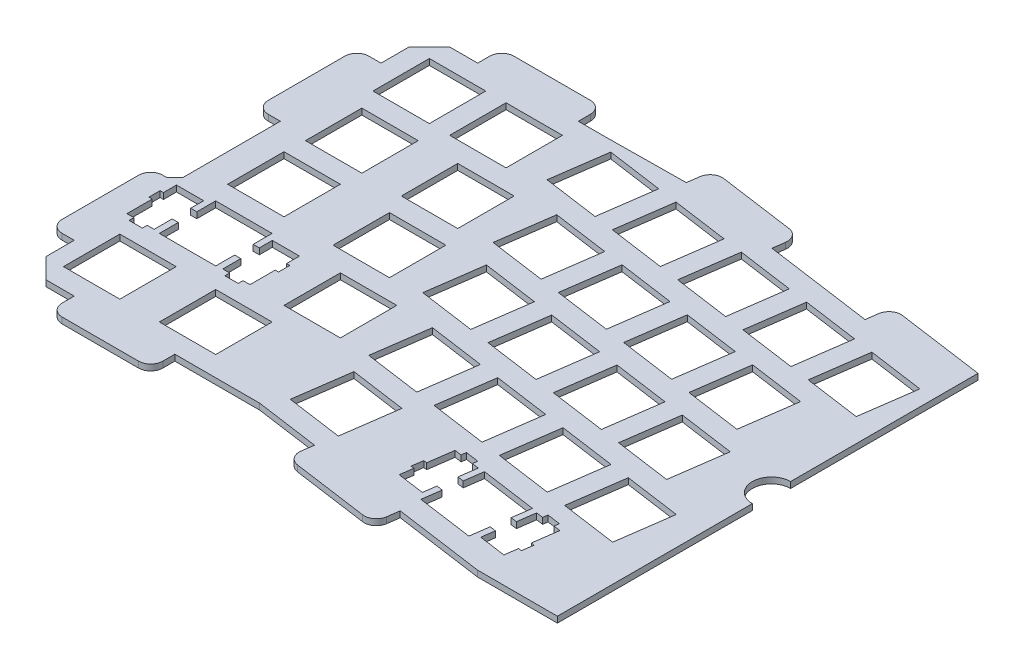
from build123d import *

# Parameters (mm, degrees)
BOSS_EXTRUDE1_DEPTH = 1.5
SKETCH2_W           = 14
SKETCH2_H           = 14
CUT_EXTRUDE1_DEPTH  = 1.5
SKETCH3_W           = 6
SKETCH3_H           = 25
SKETCH3_W_2         = 25
SKETCH3_H_2         = 6
BOSS_EXTRUDE2_DEPTH = 1.5
FILLET1_R           = 3
CHAMFER1_SIZE       = 5
CUT_EXTRUDE2_DEPTH  = 10
SKETCH5_R           = 4.75
CUT_EXTRUDE3_DEPTH  = 170.946862531
SKETCH6_W           = 33.692308385
SKETCH6_H           = 17.573728958
BOSS_EXTRUDE3_DEPTH = 1.5
CUT_EXTRUDE4_DEPTH  = 1.5
CHAMFER2_SIZE       = 2


with BuildPart() as part:
    # Sketch1 → Boss-Extrude1 (new body)
    with BuildSketch(Plane(origin=(0, 0, 0), x_dir=(1, 0, 0), z_dir=(0, 1, 0))):
        Polygon((39.045965758, 95.205083501), (-4.332989453, 95.205083501), (-4.332989453, -5), (53.746442199, -5), (116.69899904, -13.847404885), (136.518193504, -13.847404885), (136.518193504, 84.557681441), (39.466509281, 98.19740615), align=None)
    extrude(amount=-BOSS_EXTRUDE1_DEPTH)

    # Sketch2 → Cut-Extrude1 (cut)
    with BuildSketch(Plane(origin=(0, 0, 0), x_dir=(-1, 0, 0), z_dir=(0, -1, 0))):
        with Locations((-9.668032188, 45.102416218)):
            Rectangle(SKETCH2_W, SKETCH2_H)
        with Locations((-35.863224574, 45.102416218)):
            Rectangle(SKETCH2_W, SKETCH2_H)
        with Locations((-234.185537286, 44.352416218)):
            Rectangle(SKETCH2_W, SKETCH2_H)
        Polygon((-180.069515273, 51.038086867), (-178.121091859, 64.90183983), (-191.984844822, 66.850263243), (-193.933268235, 52.986510281), align=None)
        Polygon((-118.615175166, 48.647618801), (-104.751422203, 50.596042214), (-106.699845617, 64.459795177), (-120.563598579, 62.511371763), align=None)
        Polygon((-161.204167832, 48.387952413), (-159.255744418, 62.251705375), (-173.119497381, 64.200128789), (-175.067920794, 50.336375826), align=None)
        Polygon((-154.2536368, 61.546731419), (-156.202060214, 47.682978456), (-142.338307252, 45.734555043), (-140.389883838, 59.598308005), align=None)
        Polygon((-80.883592133, 53.950539723), (-67.01983917, 55.898963137), (-68.968262584, 69.762716099), (-82.832015546, 67.814292686), align=None)
        Polygon((-198.934792178, 53.688822528), (-196.986368764, 67.55257549), (-210.850121727, 69.500998903), (-212.79854514, 55.637245941), align=None)
        with Locations((-322.96393406, 58.640784798)):
            Rectangle(SKETCH2_W, SKETCH2_H)
        Polygon((-87.834278404, 67.110712128), (-101.698031366, 65.162288715), (-99.749607953, 51.298535752), (-85.88585499, 53.246959166), align=None)
        with Locations((-246.187266863, 63.403574324)):
            Rectangle(SKETCH2_W, SKETCH2_H)
        with Locations((-265.238424969, 63.403574324)):
            Rectangle(SKETCH2_W, SKETCH2_H)
        with Locations((-289.052872631, 63.403574324)):
            Rectangle(SKETCH2_W, SKETCH2_H)
        Polygon((-50.100014552, 72.41639575), (-63.963767514, 70.467972336), (-62.015344101, 56.604219374), (-48.151591138, 58.552642788), align=None)
        Polygon((-158.019711747, -8.301004785), (-157.569996377, -5.102507014), (-156.7539714, -5.217089515), (-156.36335122, -2.444404927), (-157.179376197, -2.329822426), (-156.308920813, 3.883635048), (-158.019681648, 4.123305782), (-157.852893703, 5.311279215), (-161.120178356, 5.770966057), (-161.286966042, 4.58161254), (-162.9951147, 4.821087611), (-163.616324776, 0.395822335), (-165.12645598, 0.606352683), (-164.474287078, 5.261817748), (-178.33804004, 7.210241161), (-178.991498382, 2.556075933), (-180.501662214, 2.767805684), (-179.880128073, 7.193176143), (-181.589313822, 7.433770026), (-181.421707286, 8.621759261), (-184.690062177, 9.080936661), (-184.856668188, 7.891577681), (-186.565853923, 8.132131561), (-187.435796745, 1.9220081), (-188.253885303, 2.036137069), (-188.6407454, -0.735186804), (-187.823656903, -0.849316114), (-188.272596855, -4.049463377), (-181.588872068, -4.985649306), (-181.13993164, -1.786902128), (-179.628767758, -1.998601538), (-180.283040344, -6.653992888), (-166.419287381, -8.602416301), (-165.765246552, -3.948673985), (-164.255200441, -4.161211733), (-164.704915811, -7.359709504), align=None)
        Polygon((-149.11796192, 65.920182917), (-147.169538506, 79.78393588), (-161.033291469, 81.732359293), (-162.981714882, 67.868606331), align=None)
        with Locations((-9.953349532, 64.153574324)):
            Rectangle(SKETCH2_W, SKETCH2_H)
        with Locations((-33.76869725, 64.153574324)):
            Rectangle(SKETCH2_W, SKETCH2_H)
        with Locations((-227.136108757, 63.403574324)):
            Rectangle(SKETCH2_W, SKETCH2_H)
        with Locations((-317.819621341, 1.487240475)):
            Rectangle(SKETCH2_W, SKETCH2_H)
        Polygon((-186.85036274, 71.227115774), (-184.901939327, 85.090868736), (-198.765692289, 87.03929215), (-200.714115703, 73.175539187), align=None)
        Polygon((-111.833635057, 68.839707794), (-97.969882094, 70.788131208), (-99.918305508, 84.65188417), (-113.78205847, 82.703460757), align=None)
        Polygon((-167.984780551, 68.577553418), (-166.036357138, 82.44130638), (-179.9001101, 84.389729793), (-181.848533513, 70.525976831), align=None)
        Polygon((-118.782750207, 82.000762559), (-132.646503169, 80.052339146), (-130.698079756, 66.188586183), (-116.834326793, 68.137009597), align=None)
        Polygon((-109.593099656, 1.590456432), (-111.104192143, 1.378248006), (-111.725216783, 5.806119012), (-113.434321388, 5.566309496), (-113.601328022, 6.754282206), (-116.868527992, 6.295363984), (-116.701521361, 5.106091194), (-118.412100582, 4.865622818), (-117.540539141, -1.344083322), (-118.357579438, -1.458557181), (-117.967328677, -4.231333791), (-117.15028849, -4.11550985), (-116.69899904, -7.315467432), (-110.015669744, -6.375063026), (-110.464958957, -3.176515366), (-108.95488455, -2.964078805), (-108.29946364, -7.617978062), (-94.435710678, -5.669554648), (-95.090671173, -1.014250495), (-93.579575699, -0.802063343), (-93.130602906, -4.000655434), (-86.445280497, -3.060922216), (-86.894753343, 0.136379804), (-86.077301679, 0.252072909), (-86.467478152, 3.024948118), (-87.284529769, 2.910555086), (-88.158277101, 9.118947378), (-89.865884991, 8.879161897), (-90.032374871, 10.06713695), (-93.30138141, 9.608264754), (-93.133391438, 8.420389682), (-94.842499419, 8.180604226), (-94.220537055, 3.75272446), (-95.729632386, 3.541837354), (-96.384372727, 8.194164776), (-110.248125689, 6.245741363), align=None)
        Polygon((-70.569538559, -2.315194142), (-56.705785596, -0.366770729), (-58.65420901, 13.496982234), (-72.517961972, 11.54855882), align=None)
        Polygon((-197.078489417, -4.296643347), (-195.130066004, 9.567109615), (-208.993818966, 11.515533029), (-210.94224238, -2.348219934), align=None)
        with Locations((-279.717305129, 1.487240475)):
            Rectangle(SKETCH2_W, SKETCH2_H)
        with Locations((-298.768463235, 1.487240475)):
            Rectangle(SKETCH2_W, SKETCH2_H)
        with Locations((-322.96393406, 82.45473243)):
            Rectangle(SKETCH2_W, SKETCH2_H)
        Polygon((-74.102047689, 74.142974794), (-60.238294726, 76.091398208), (-62.18671814, 89.95515117), (-76.050471102, 88.006727757), align=None)
        Polygon((-205.716164344, 73.880034967), (-203.76774093, 87.743787929), (-217.631493893, 89.692211343), (-219.579917306, 75.828458381), align=None)
        Polygon((-81.052841084, 87.303307487), (-94.916594046, 85.354884074), (-92.968170633, 71.491131111), (-79.10441767, 73.439554525), align=None)
        with Locations((-6.998481741, 7.003238337)):
            Rectangle(SKETCH2_W, SKETCH2_H)
        with Locations((-30.815317716, 7)):
            Rectangle(SKETCH2_W, SKETCH2_H)
        with Locations((-236.852699421, 6.25)):
            Rectangle(SKETCH2_W, SKETCH2_H)
        with Locations((-255.901857405, 6.25)):
            Rectangle(SKETCH2_W, SKETCH2_H)
        with Locations((-233.805365226, 82.45473243)):
            Rectangle(SKETCH2_W, SKETCH2_H)
        with Locations((-252.853672108, 82.45473243)):
            Rectangle(SKETCH2_W, SKETCH2_H)
        with Locations((-271.905830275, 82.45473243)):
            Rectangle(SKETCH2_W, SKETCH2_H)
        with Locations((-290.956988381, 82.45473243)):
            Rectangle(SKETCH2_W, SKETCH2_H)
        Polygon((-108.592251265, 11.582331056), (-94.728498302, 13.53075447), (-96.676921716, 27.394507432), (-110.540674678, 25.446084019), align=None)
        Polygon((-161.788545221, 9.991186757), (-159.840121808, 23.854939719), (-173.70387477, 25.803363133), (-175.652298184, 11.93961017), align=None)
        Polygon((-127.460208932, 8.930145226), (-113.59645597, 10.87856864), (-115.544879383, 24.742321602), (-129.408632345, 22.793898189), align=None)
        Polygon((-154.838722397, 23.151841648), (-156.787145811, 9.288088686), (-142.923392848, 7.339665272), (-140.974969435, 21.203418235), align=None)
        Polygon((-55.233717661, 76.795522435), (-41.369964699, 78.743945848), (-43.318388112, 92.607698811), (-57.182141074, 90.659275397), align=None)
        with Locations((-7.667010547, 83.205083501)):
            Rectangle(SKETCH2_W, SKETCH2_H)
        with Locations((-26.718168653, 83.20473243)):
            Rectangle(SKETCH2_W, SKETCH2_H)
        Polygon((-199.52007302, 15.292392375), (-197.571649607, 29.156145338), (-211.435402569, 31.104568751), (-213.383825983, 17.240815789), align=None)
        with Locations((-298.578451684, 20.53836858)):
            Rectangle(SKETCH2_W, SKETCH2_H)
        Polygon((-89.728743935, 14.231849796), (-75.864990972, 16.18027321), (-77.813414386, 30.044026172), (-91.677167348, 28.095602759), align=None)
        Polygon((-192.570245983, 28.454627882), (-194.518669396, 14.59087492), (-180.654916434, 12.642451506), (-178.70649302, 26.506204468), align=None)
        Polygon((-58.950293343, 32.692188142), (-72.814046306, 30.743764728), (-70.865622892, 16.880011766), (-57.00186993, 18.82843518), align=None)
        with Locations((-246.187266863, 25.301158106)):
            Rectangle(SKETCH2_W, SKETCH2_H)
        with Locations((-270.001714525, 25.301158106)):
            Rectangle(SKETCH2_W, SKETCH2_H)
        Polygon((-120.681140481, 29.119160818), (-106.817387518, 31.067584231), (-108.765810932, 44.931337194), (-122.629563894, 42.98291378), align=None)
        Polygon((-149.70549572, 27.532693306), (-147.757072306, 41.396446268), (-161.620825269, 43.344869682), (-163.569248682, 29.481116719), align=None)
        with Locations((-42.722341535, 26.051158106)):
            Rectangle(SKETCH2_W, SKETCH2_H)
        with Locations((-227.23185535, 25.301158106)):
            Rectangle(SKETCH2_W, SKETCH2_H)
        Polygon((-29.421107438, 31.582068801), (-29.421107438, 28.35187244), (-30.245257537, 28.35187244), (-30.245257537, 25.551953285), (-29.421107438, 25.551953285), (-29.421107438, 19.281372101), (-27.695902564, 19.281372101), (-27.695902564, 18.080999131), (-24.395201917, 18.080999131), (-24.395201917, 19.281372101), (-22.671197116, 19.281372101), (-22.671197116, 23.751943863), (-21.145604376, 23.751943863), (-21.145604376, 19.051158106), (-7.145604376, 19.051158106), (-7.145604376, 23.751943863), (-5.620011636, 23.751943863), (-5.620011636, 19.281372101), (-3.894506744, 19.281372101), (-3.894506744, 18.080999131), (-0.594006109, 18.080999131), (-0.594006109, 19.281372101), (1.130048695, 19.281372101), (1.130048695, 25.551953285), (1.955568878, 25.551953285), (1.955568878, 28.352123505), (1.130048695, 28.352123505), (1.130048695, 31.582319866), (-5.620011636, 31.582319866), (-5.620011636, 28.352123505), (-7.145604376, 28.352123505), (-7.145604376, 33.051158106), (-21.145604376, 33.051158106), (-21.145604376, 28.35187244), (-22.671197116, 28.35187244), (-22.671197116, 31.582068801), align=None)
        with Locations((-322.96393406, 39.589626692)):
            Rectangle(SKETCH2_W, SKETCH2_H)
        Polygon((-187.437211725, 32.834012067), (-185.488788311, 46.697765029), (-199.352541274, 48.646188443), (-201.300964687, 34.78243548), align=None)
        Polygon((-101.814497943, 31.769730407), (-87.950744981, 33.718153821), (-89.899168394, 47.581906783), (-103.762921357, 45.63348337), align=None)
        Polygon((-180.486814754, 45.997649448), (-182.435238167, 32.133896486), (-168.571485205, 30.185473073), (-166.623061792, 44.049226035), align=None)
        Polygon((-64.081134293, 37.074257567), (-50.217381331, 39.02268098), (-52.165804744, 52.886433942), (-66.029557706, 50.938010529), align=None)
        Polygon((-206.302405022, 35.483942028), (-204.353981609, 49.347694991), (-218.217734571, 51.296118404), (-220.166157984, 37.432365442), align=None)
        Polygon((-71.033829817, 50.233426184), (-84.89758278, 48.285002771), (-82.949159366, 34.421249808), (-69.085406404, 36.369673222), align=None)
        with Locations((-253.236695392, 44.352416218)):
            Rectangle(SKETCH2_W, SKETCH2_H)
        Polygon((-294.443774816, 36.382257243), (-294.443774816, 37.5824302), (-292.719670009, 37.5824302), (-292.719670009, 42.053101969), (-291.194577299, 42.053101969), (-291.194577299, 37.352416218), (-277.194577299, 37.352416218), (-277.194577299, 42.053101969), (-275.66948459, 42.053101969), (-275.66948459, 37.5824302), (-273.943379661, 37.5824302), (-273.943379661, 36.382257243), (-270.643179045, 36.382257243), (-270.643179045, 37.5824302), (-268.919074237, 37.5824302), (-268.919074237, 43.853111391), (-268.094024083, 43.853111391), (-268.094024083, 46.653281611), (-268.919074237, 46.653281611), (-268.919074237, 49.883477972), (-275.66948459, 49.883477972), (-275.66948459, 46.653281611), (-277.194577299, 46.653281611), (-277.194577299, 51.352416218), (-291.194577299, 51.352416218), (-291.194577299, 46.653130552), (-292.719670009, 46.653130552), (-292.719670009, 49.883326913), (-299.470080361, 49.883326913), (-299.470080361, 46.653130552), (-300.294130454, 46.653130552), (-300.294130454, 43.853111391), (-299.470080361, 43.853111391), (-299.470080361, 37.5824302), (-297.743975432, 37.5824302), (-297.743975432, 36.382257243), align=None)
    extrude(amount=CUT_EXTRUDE1_DEPTH, mode=Mode.SUBTRACT)

    # Sketch3 → Boss-Extrude2 (add)
    with BuildSketch(Plane(origin=(0, 0, 0), x_dir=(1, 0, 0), z_dir=(0, 1, 0))):
        with Locations((-7.332989453, 70.705083501)):
            Rectangle(SKETCH3_W, SKETCH3_H)
        with Locations((-7.332989453, 19.5)):
            Rectangle(SKETCH3_W, SKETCH3_H)
        with Locations((20.167010547, -8)):
            Rectangle(SKETCH3_W_2, SKETCH3_H_2)
        Polygon((69.590731299, -7.226769615), (94.347433018, -10.706097139), (93.512394412, -16.647705552), (68.755692694, -13.168378028), align=None)
        with Locations((20.167010547, 98.205083501)):
            Rectangle(SKETCH3_W_2, SKETCH3_H_2)
        Polygon((59.271870656, 95.413944131), (84.028572374, 91.934616607), (84.86361098, 97.87622502), (60.106909262, 101.355552544), align=None)
        Polygon((110.926453179, 88.154365987), (136.518193504, 84.557681441), (136.518193504, 90.616646876), (111.761491785, 94.0959744), align=None)
    extrude(amount=-BOSS_EXTRUDE2_DEPTH)

    # Fillet1
    fillet1_edges = [part.edges().sort_by_distance(p)[0] for p in [
        (93.512394412, -0.75, 16.647705552),
        (68.755692694, -0.75, 13.168378028),
        (32.667010547, -0.75, 11),
        (7.667010547, -0.75, 11),
        (-10.332989453, -0.75, -7),
        (-10.332989453, -0.75, -32),
        (-10.332989453, -0.75, -58.205083501),
        (-10.332989453, -0.75, -83.205083501),
        (111.761491785, -0.75, -94.0959744),
        (84.86361098, -0.75, -97.87622502),
        (60.106909262, -0.75, -101.355552544),
        (32.667010547, -0.75, -101.205083501),
        (7.667010547, -0.75, -101.205083501),
    ]]
    fillet(fillet1_edges, radius=FILLET1_R)

    # Chamfer1
    chamfer1_edges = [part.edges().sort_by_distance(p)[0] for p in [
        (-4.332989453, -0.75, 5),
        (-4.332989453, -0.75, -95.205083501),
    ]]
    chamfer(chamfer1_edges, length=CHAMFER1_SIZE)

    # Sketch4 → Cut-Extrude2 (cut)
    with BuildSketch(Plane(origin=(0, 0, 0), x_dir=(1, 0, 0), z_dir=(0, 1, 0))):
        Polygon((59.271870656, 95.413944131), (39.045965758, 95.205083501), (39.466509281, 98.19740615), align=None)
    extrude(amount=-CUT_EXTRUDE2_DEPTH, mode=Mode.SUBTRACT)

    # Sketch5 → Cut-Extrude3 (cut, through all)
    with BuildSketch(Plane(origin=(0, 0, 0), x_dir=(1, 0, 0), z_dir=(0, 1, 0))):
        with Locations((136.518193504, 39.320563904)):
            Circle(SKETCH5_R)
    extrude(amount=-CUT_EXTRUDE3_DEPTH, mode=Mode.SUBTRACT)

    # Sketch6 → Boss-Extrude3 (add)
    with BuildSketch(Plane(origin=(0, 0, 0), x_dir=(1, 0, 0), z_dir=(0, 1, 0))):
        with Locations((14.655669489, 26.42047638)):
            Rectangle(SKETCH6_W, SKETCH6_H)
    extrude(amount=-BOSS_EXTRUDE3_DEPTH)

    # Sketch7 → Cut-Extrude4 (cut)
    with BuildSketch(Plane(origin=(0, 0, 0), x_dir=(1, 0, 0), z_dir=(0, 1, 0))):
        Polygon((27.039857438, 28.35187244), (27.039857438, 31.582068801), (20.289947116, 31.582068801), (20.289947116, 28.35187244), (18.764354376, 28.35187244), (18.764354376, 33.051158106), (4.764354376, 33.051158106), (4.764354376, 28.352123505), (3.238761636, 28.352123505), (3.238761636, 31.582319866), (-3.511298695, 31.582319866), (-3.511298695, 28.352123505), (-4.336818878, 28.352123505), (-4.336818878, 25.551953285), (-3.511298695, 25.551953285), (-3.511298695, 19.281372101), (-1.787243891, 19.281372101), (-1.787243891, 18.080999131), (1.513256744, 18.080999131), (1.513256744, 19.281372101), (3.238761636, 19.281372101), (3.238761636, 23.751943863), (4.764354376, 23.751943863), (4.764354376, 19.051158106), (18.764354376, 19.051158106), (18.764354376, 23.751943863), (20.289947116, 23.751943863), (20.289947116, 19.281372101), (22.013951917, 19.281372101), (22.013951917, 18.080999131), (25.314652564, 18.080999131), (25.314652564, 19.281372101), (27.039857438, 19.281372101), (27.039857438, 25.551953285), (27.864007537, 25.551953285), (27.864007537, 28.35187244), align=None)
    extrude(amount=-CUT_EXTRUDE4_DEPTH, mode=Mode.SUBTRACT)

    # Chamfer2
    chamfer2_edges = [part.edges().sort_by_distance(p)[0] for p in [
        (-4.332989453, -0.75, -32),
    ]]
    chamfer(chamfer2_edges, length=CHAMFER2_SIZE)


solid = part.part
